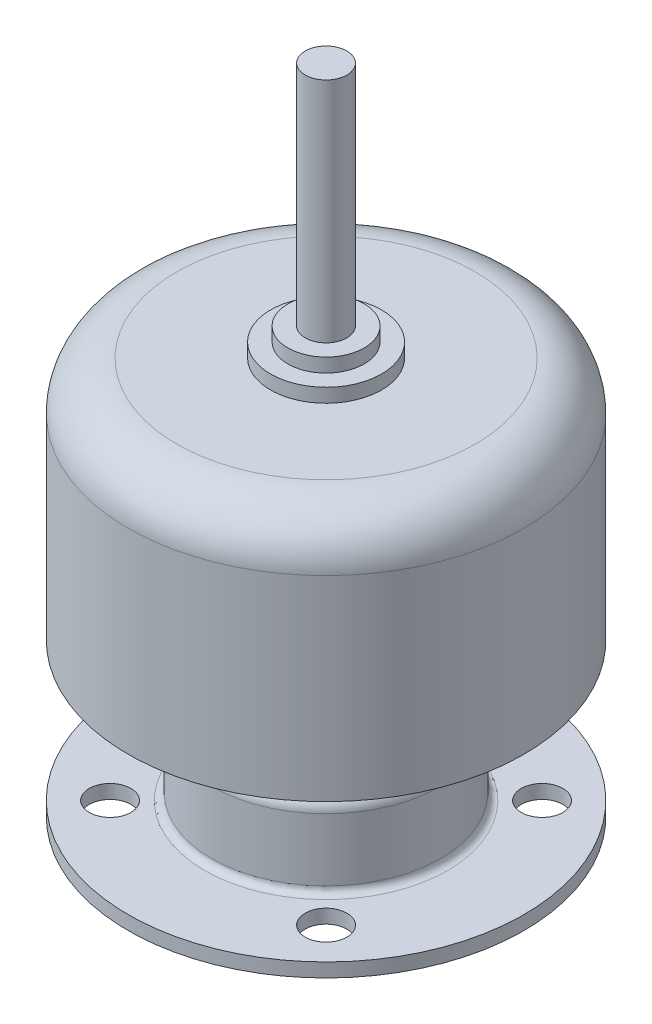
from build123d import *

# Parameters (mm, degrees)
REDONDEO4_R           = 3.5
CROQUIS7_R            = 1.5
CORTAR_EXTRUIR1_DEPTH = 10
REDONDEO5_R           = 1
REDONDEO6_R           = 0.5


with BuildPart() as part:
    # Croquis3 → Revolución2 (revolve)
    with BuildSketch(Plane.XY, mode=Mode.PRIVATE) as revoluci_n2_sk:
        Polygon((0, 47), (0, 0), (14.25, 0), (14.25, 1), (8.25, 1), (8.25, 7), (6.5, 7), (6.5, 11), (14.25, 11), (14.25, 28.6), (4, 28.6), (4, 29.6), (2.75, 29.6), (2.75, 30.6), (1.5, 30.6), (1.5, 47), align=None)
    revolve(revoluci_n2_sk.sketch.rotate(Axis((0, 0, 0), (0, 1, 0)), 90), axis=Axis((0, 0, 0), (0, 1, 0)))

    # Redondeo4
    redondeo4_edges = [part.edges().sort_by_distance(p)[0] for p in [
        (0, 28.6, 14.25),
    ]]
    fillet(redondeo4_edges, radius=REDONDEO4_R)

    # Croquis7 → Cortar-Extruir1 (cut)
    with BuildSketch(Plane.XZ):
        with Locations(Location((7.778174593, 7.778174593, 0), (0, 0, 270))):
            Circle(CROQUIS7_R)
        with Locations(Location((7.778174593, -7.778174593, 0), (0, 0, 270))):
            Circle(CROQUIS7_R)
        with Locations(Location((-7.778174593, -7.778174593, 0), (0, 0, 270))):
            Circle(CROQUIS7_R)
        with Locations(Location((-7.778174593, 7.778174593, 0), (0, 0, 270))):
            Circle(CROQUIS7_R)
    extrude(amount=-CORTAR_EXTRUIR1_DEPTH, mode=Mode.SUBTRACT)

    # Redondeo5
    redondeo5_edges = [part.edges().sort_by_distance(p)[0] for p in [
        (0, 7, 8.25),
    ]]
    fillet(redondeo5_edges, radius=REDONDEO5_R)

    # Redondeo6
    redondeo6_edges = [part.edges().sort_by_distance(p)[0] for p in [
        (0, 1, 8.25),
    ]]
    fillet(redondeo6_edges, radius=REDONDEO6_R)


solid = part.part
